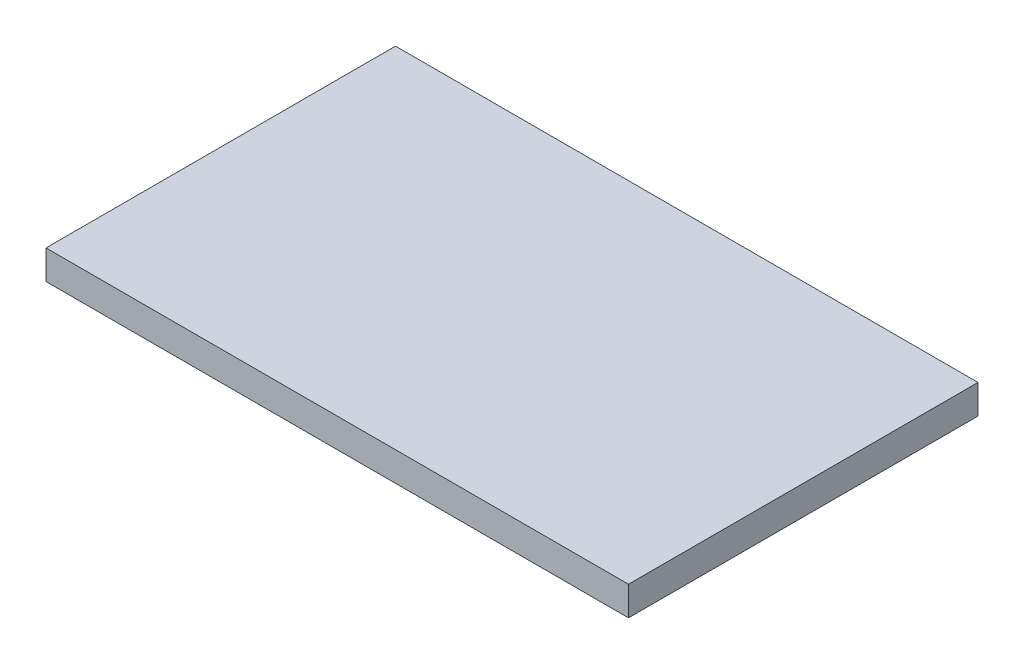
from build123d import *

# Parameters (mm, degrees)
SKETCH1_W           = 508
SKETCH1_H           = 304.8
BOSS_EXTRUDE1_DEPTH = 25.4


with BuildPart() as part:
    # Sketch1 → Boss-Extrude1 (new body)
    with BuildSketch(Plane(origin=(0, 0, 0), x_dir=(1, 0, 0), z_dir=(0, 1, 0))):
        Rectangle(SKETCH1_W, SKETCH1_H)
    extrude(amount=BOSS_EXTRUDE1_DEPTH)


solid = part.part
